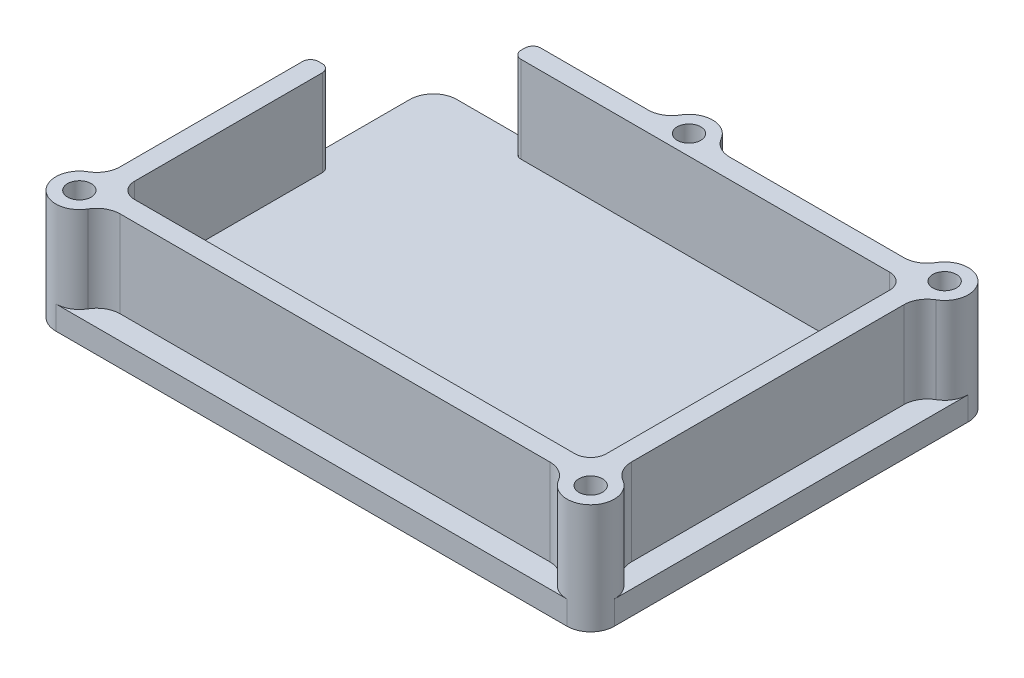
from build123d import *

# Parameters (mm, degrees)
SKETCH5_R           = 1.5
BOSS_EXTRUDE2_DEPTH = 3
SKETCH6_R           = 1.5
BOSS_EXTRUDE3_DEPTH = 11


with BuildPart() as part:
    # Sketch5 → Boss-Extrude2 (new body)
    with BuildSketch(Plane(origin=(0, 0, 0), x_dir=(1, 0, 0), z_dir=(0, 1, 0))):
        with BuildLine():
            Line((-5.196152423, 22.5), (-29.5, 22.5))
            ThreePointArc((-29.5, 22.5), (-31.621320344, 21.621320344), (-32.5, 19.5))
            Line((-32.5, 19.5), (-32.5, -17.303847577))
            ThreePointArc((-32.5, -17.303847577), (-32.901923789, -18.803847577), (-34, -19.901923789))
            ThreePointArc((-34, -19.901923789), (-35.397777479, -23.276457135), (-32.5, -25.5))
            Line((-32.5, -25.5), (32.5, -25.5))
            ThreePointArc((32.5, -25.5), (34.621320344, -24.621320344), (35.5, -22.5))
            Line((35.5, -22.5), (35.5, 22.5))
            ThreePointArc((35.5, 22.5), (34.621320344, 24.621320344), (32.5, 25.5))
            Line((32.5, 25.5), (0, 25.5))
            ThreePointArc((0, 25.5), (-1.5, 25.098076211), (-2.598076211, 24))
            ThreePointArc((-2.598076211, 24), (-3.696152423, 22.901923789), (-5.196152423, 22.5))
        make_face()
        with Locations(Location((0, 22.5, 0), (0, 0, 270))):
            Circle(SKETCH5_R, mode=Mode.SUBTRACT)
        with Locations(Location((32.5, 22.5, 0), (0, 0, 270))):
            Circle(SKETCH5_R, mode=Mode.SUBTRACT)
        with Locations(Location((32.5, -22.5, 0), (0, 0, 270))):
            Circle(SKETCH5_R, mode=Mode.SUBTRACT)
        with Locations(Location((-32.5, -22.5, 0), (0, 0, 270))):
            Circle(SKETCH5_R, mode=Mode.SUBTRACT)
    extrude(amount=BOSS_EXTRUDE2_DEPTH)

    # Sketch6 → Boss-Extrude3 (add)
    with BuildSketch(Plane(origin=(0, 3, 0), x_dir=(1, 0, 0), z_dir=(0, 1, 0))):
        with BuildLine():
            Line((-32.5, 5.885087138), (-32.5, -17.303847577))
            ThreePointArc((-32.5, -17.303847577), (-32.901923789, -18.803847577), (-34, -19.901923789))
            ThreePointArc((-34, -19.901923789), (-34.621320344, -24.621320344), (-29.901923789, -24))
            ThreePointArc((-29.901923789, -24), (-28.803847577, -22.901923789), (-27.303847577, -22.5))
            Line((-27.303847577, -22.5), (27.303847577, -22.5))
            ThreePointArc((27.303847577, -22.5), (28.803847577, -22.901923789), (29.901923789, -24))
            ThreePointArc((29.901923789, -24), (34.621320344, -24.621320344), (34, -19.901923789))
            ThreePointArc((34, -19.901923789), (32.901923789, -18.803847577), (32.5, -17.303847577))
            Line((32.5, -17.303847577), (32.5, 17.303847577))
            ThreePointArc((32.5, 17.303847577), (32.901923789, 18.803847577), (34, 19.901923789))
            ThreePointArc((34, 19.901923789), (34.621320344, 24.621320344), (29.901923789, 24))
            ThreePointArc((29.901923789, 24), (28.803847577, 22.901923789), (27.303847577, 22.5))
            Line((27.303847577, 22.5), (5.196152423, 22.5))
            ThreePointArc((5.196152423, 22.5), (3.696152423, 22.901923789), (2.598076211, 24))
            ThreePointArc((2.598076211, 24), (0, 25.5), (-2.598076211, 24))
            ThreePointArc((-2.598076211, 24), (-3.696152423, 22.901923789), (-5.196152423, 22.5))
            Line((-5.196152423, 22.5), (-18.854157071, 22.5))
            ThreePointArc((-18.854157071, 22.5), (-19.561263852, 22.207106781), (-19.854157071, 21.5))
            Line((-19.854157071, 21.5), (-19.854157071, 21))
            ThreePointArc((-19.854157071, 21), (-19.561263852, 20.292893219), (-18.854157071, 20))
            Line((-18.854157071, 20), (28, 20))
            ThreePointArc((28, 20), (29.414213562, 19.414213562), (30, 18))
            Line((30, 18), (30, -18))
            ThreePointArc((30, -18), (29.414213562, -19.414213562), (28, -20))
            Line((28, -20), (-28, -20))
            ThreePointArc((-28, -20), (-29.414213562, -19.414213562), (-30, -18))
            Line((-30, -18), (-30, 5.885087138))
            ThreePointArc((-30, 5.885087138), (-30.292893219, 6.592193919), (-31, 6.885087138))
            Line((-31, 6.885087138), (-31.5, 6.885087138))
            ThreePointArc((-31.5, 6.885087138), (-32.207106781, 6.592193919), (-32.5, 5.885087138))
        make_face()
        with Locations(Location((0, 22.5, 0), (0, 0, 270))):
            Circle(SKETCH6_R, mode=Mode.SUBTRACT)
        with Locations(Location((32.5, 22.5, 0), (0, 0, 270))):
            Circle(SKETCH6_R, mode=Mode.SUBTRACT)
        with Locations(Location((32.5, -22.5, 0), (0, 0, 270))):
            Circle(SKETCH6_R, mode=Mode.SUBTRACT)
        with Locations(Location((-32.5, -22.5, 0), (0, 0, 270))):
            Circle(SKETCH6_R, mode=Mode.SUBTRACT)
    extrude(amount=BOSS_EXTRUDE3_DEPTH)


solid = part.part
